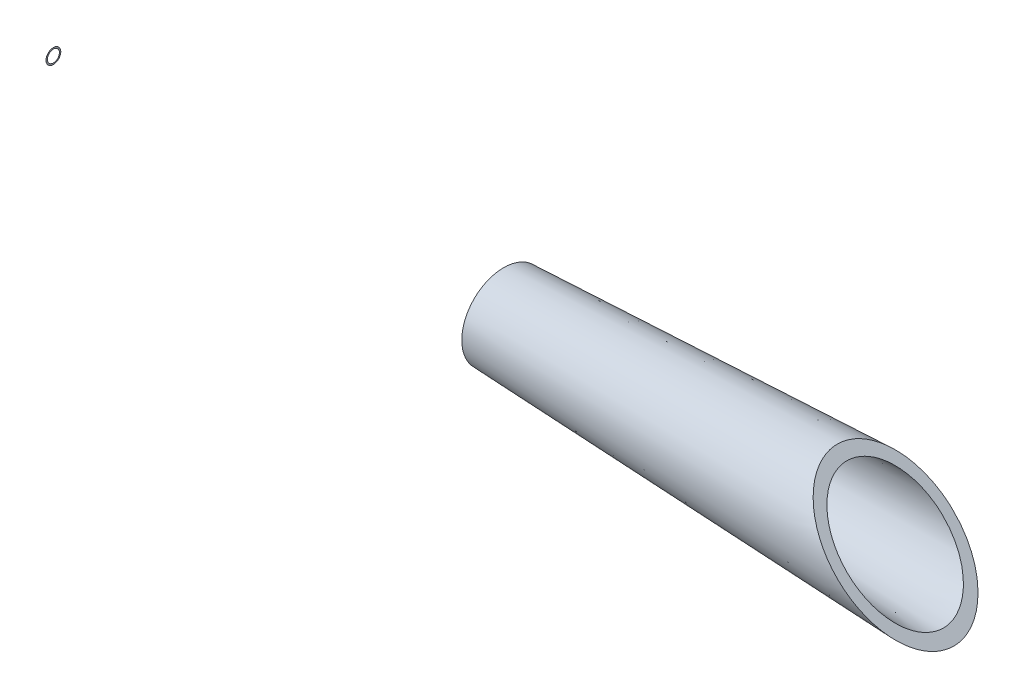
from build123d import *


with BuildPart() as part:
    # Sketch2 → Revolve2 (revolve)
    with BuildSketch(Plane.XY, mode=Mode.PRIVATE) as revolve2_sk:
        with BuildLine():
            Line((0, 1.2), (50, 4.696340597))
            Line((50, 4.696340597), (50, 6.696340597))
            Line((50, 6.696340597), (1.851094968, 3.32944117))
            ThreePointArc((1.851094968, 3.32944117), (0.484525778, 2.648094905), (0, 1.2))
        make_face()
    revolve(revolve2_sk.sketch.rotate(Axis((-19.275847123, 0, 0), (1, 0, 0)), 90), axis=Axis((-19.275847123, 0, 0), (1, 0, 0)))

    # SurfaceCut9
    split(bisect_by=Plane(origin=(0, 0, 0), x_dir=(0, 0, -1), z_dir=(1, 0, 0)), keep=Keep.BOTTOM)


with BuildPart() as body_2:
    # Sketch3 → Revolve3 (revolve)
    with BuildSketch(Plane.XY, mode=Mode.PRIVATE) as revolve3_sk:
        Polygon((50, 4.694584717), (180, 10.143199062), (180, 12.144954942), (50, 6.696340597), align=None)
    revolve(revolve3_sk.sketch.rotate(Axis((50, 0, 0), (-1, 0, 0)), 90), axis=Axis((50, 0, 0), (-1, 0, 0)))

    # SurfaceCut12
    split(bisect_by=Plane(origin=(90, 0, 0), x_dir=(0, 0, -1), z_dir=(1, 0, 0)), keep=Keep.TOP)

    # SurfaceCut13
    split(bisect_by=Plane(origin=(83.9275, 83.9275, 0), x_dir=(0, 0, 1), z_dir=(-0.7071067811865512, -0.7071067811865438, 0)), keep=Keep.TOP)


solid = Compound([part.part, body_2.part])
